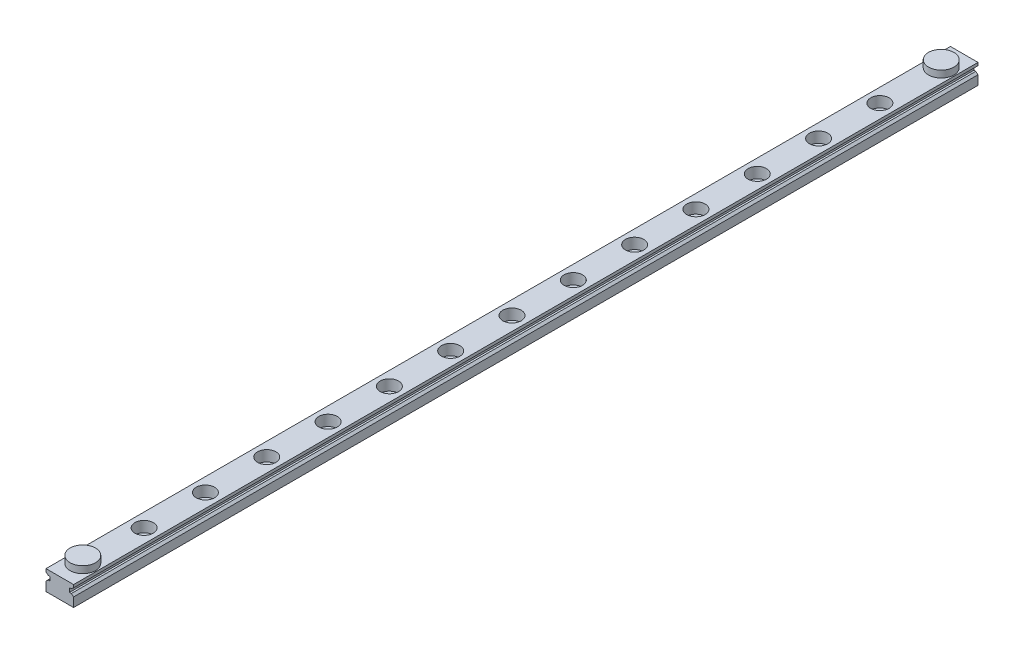
from build123d import *

# Parameters (mm, degrees)
BOSS_EXTRUDE1_DEPTH = 295
SKETCH2_R           = 1.75
CUT_EXTRUDE1_DEPTH  = 296.105913191
SKETCH2_3_R         = 3
SKETCH2_3_R_2       = 1.75
CUT_EXTRUDE2_DEPTH  = 3.5
LPATTERN1_COUNT     = 15
LPATTERN1_PITCH     = 20
SKETCH4_R           = 4.15
BOSS_EXTRUDE2_DEPTH = 2.25
LPATTERN2_COUNT     = 2
LPATTERN2_PITCH     = 280


with BuildPart() as part:
    # Sketch1 → Boss-Extrude1 (new body)
    with BuildSketch(Plane.XY):
        Polygon((4.5, 0), (-4.5, 0), (-4.5, 3), (-3.775867518, 3.607619299), (-3.168844988, 3.607619299), (-3.168844988, 4.95), (-3.775867518, 4.95), (-4.5, 5.557619299), (-4.5, 6.5), (0, 6.5), (4.5, 6.5), (4.5, 5.557619299), (3.775867518, 4.95), (3.168844988, 4.95), (3.168844988, 3.607619299), (3.775867518, 3.607619299), (4.5, 3), align=None)
    extrude(amount=BOSS_EXTRUDE1_DEPTH)

    # Sketch2 → Cut-Extrude1 (cut, through all)
    with BuildSketch(Plane(origin=(0, 6.5, 0), x_dir=(1, 0, 0), z_dir=(0, 1, 0))):
        with Locations((0, -7.5)):
            Circle(SKETCH2_R)
    cut_extrude1 = extrude(amount=-CUT_EXTRUDE1_DEPTH, mode=Mode.SUBTRACT)

    # Sketch2<3> → Cut-Extrude2 (cut)
    with BuildSketch(Plane(origin=(0, 6.5, 0), x_dir=(1, 0, 0), z_dir=(0, 1, 0))):
        with Locations((0, -7.5)):
            Circle(SKETCH2_3_R)
        with Locations((0, -7.5)):
            Circle(SKETCH2_3_R_2, mode=Mode.SUBTRACT)
    cut_extrude2 = extrude(amount=-CUT_EXTRUDE2_DEPTH, mode=Mode.SUBTRACT)

    # LPattern1: Cut-Extrude1, Cut-Extrude2 ×15
    with Locations(*[(0, 0, i * LPATTERN1_PITCH) for i in range(1, LPATTERN1_COUNT)]):
        add(cut_extrude1, mode=Mode.SUBTRACT)
        add(cut_extrude2, mode=Mode.SUBTRACT)

    # Sketch4 → Boss-Extrude2 (add)
    with BuildSketch(Plane(origin=(0, 6.5, 0), x_dir=(1, 0, 0), z_dir=(0, 1, 0))):
        with Locations((0, -7.5)):
            Circle(SKETCH4_R)
    boss_extrude2 = extrude(amount=BOSS_EXTRUDE2_DEPTH)

    # LPattern2: Boss-Extrude2 ×2
    with Locations(*[(0, 0, i * LPATTERN2_PITCH) for i in range(1, LPATTERN2_COUNT)]):
        add(boss_extrude2)


solid = part.part
